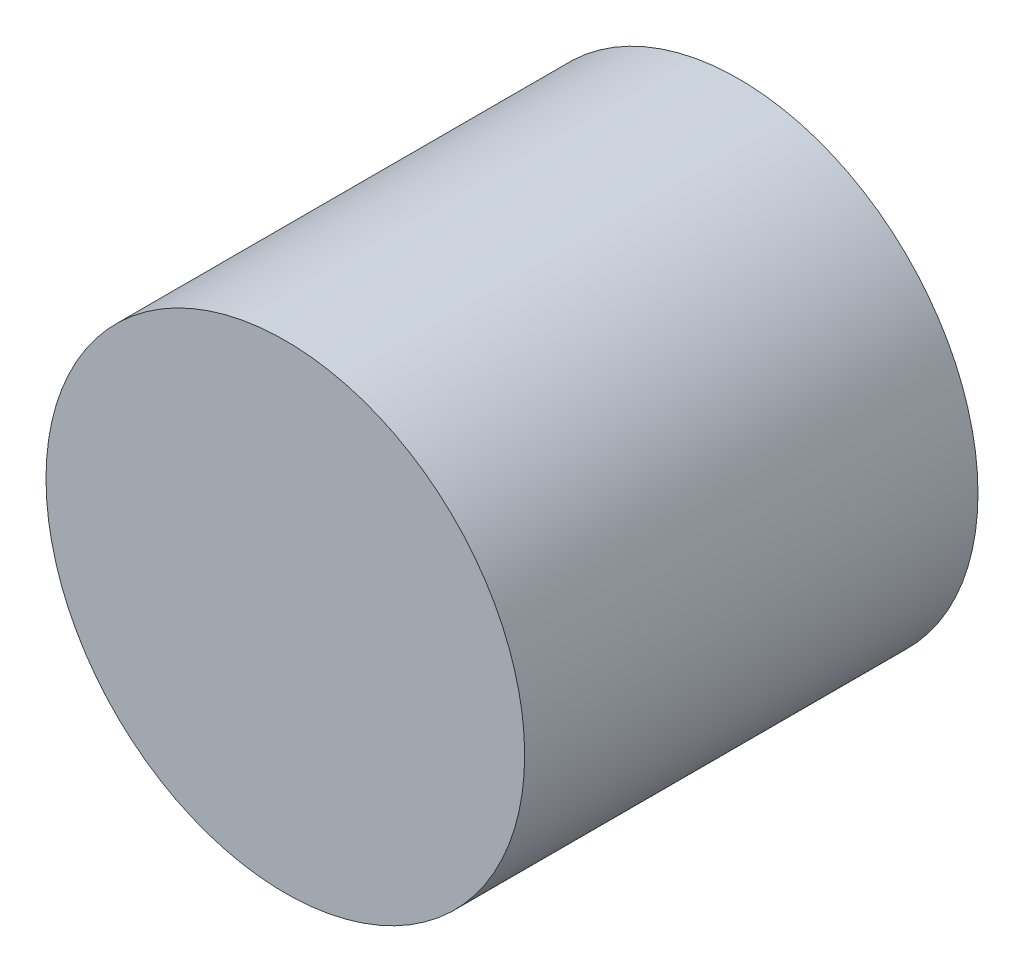
from build123d import *

# Parameters (mm, degrees)
SKETCH1_R           = 47.511973794
BOSS_EXTRUDE1_DEPTH = 90


with BuildPart() as part:
    # Sketch1 → Boss-Extrude1 (new body)
    with BuildSketch(Plane.XY):
        with Locations(Location((0, 0, 0), (0, 0, 180))):
            Circle(SKETCH1_R)
    extrude(amount=BOSS_EXTRUDE1_DEPTH)


solid = part.part
